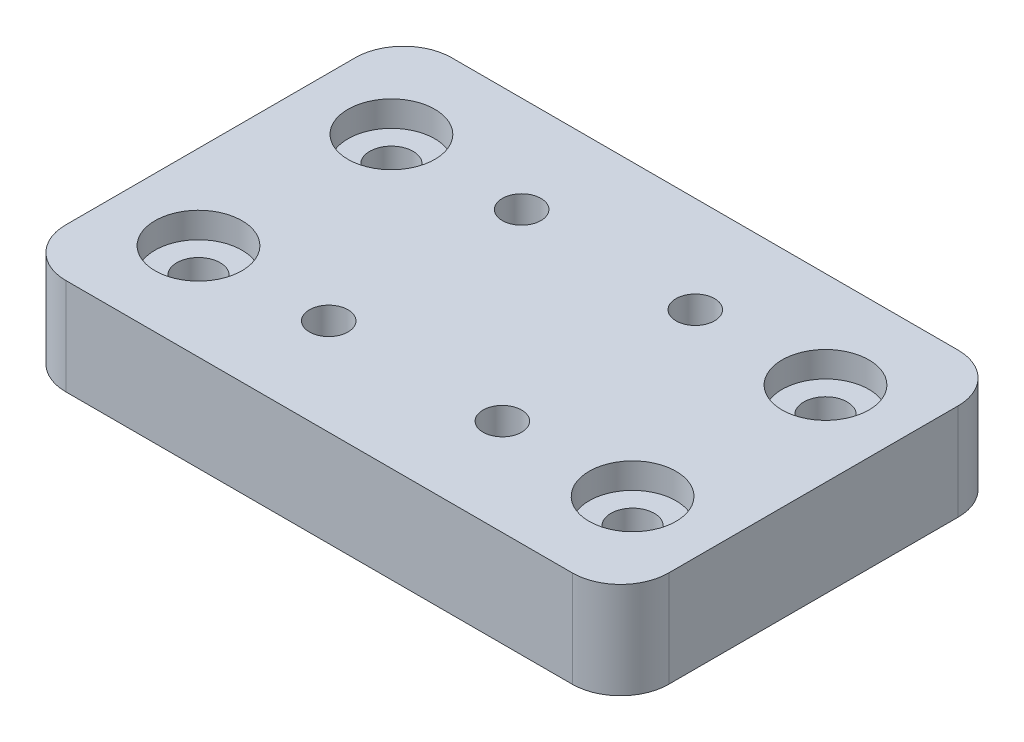
from build123d import *

# Parameters (mm, degrees)
DODANIE_WYCI_GNI_CIE1_DEPTH                       = 20
OTWORY_USTALAJ_CE_8_0MM1_D                        = 8
OTWORY_USTALAJ_CE_8_0MM1_DEPTH                    = 15
OTWORY_USTALAJ_CE_8_0MM1_TIP                      = 2.403442476
POG_BIENIE_WALCOWE_POD_M8_RUB_Z_BEM_S_D           = 9
POG_BIENIE_WALCOWE_POD_M8_RUB_Z_BEM_S_CBORE_D     = 18.011
POG_BIENIE_WALCOWE_POD_M8_RUB_Z_BEM_S_CBORE_DEPTH = 5.3


with BuildPart() as part:
    # Szkic1 → Dodanie-wyciągnięcie1 (new body)
    with BuildSketch(Plane(origin=(0, 0, 0), x_dir=(1, 0, 0), z_dir=(0, 1, 0))):
        with BuildLine():
            Line((-52.5, -40), (52.5, -40))
            ThreePointArc((52.5, -40), (59.571067812, -37.071067812), (62.5, -30))
            Line((62.5, -30), (62.5, 30))
            ThreePointArc((62.5, 30), (59.571067812, 37.071067812), (52.5, 40))
            Line((52.5, 40), (-52.5, 40))
            ThreePointArc((-52.5, 40), (-59.571067812, 37.071067812), (-62.5, 30))
            Line((-62.5, 30), (-62.5, -30))
            ThreePointArc((-62.5, -30), (-59.571067812, -37.071067812), (-52.5, -40))
        make_face()
    extrude(amount=DODANIE_WYCI_GNI_CIE1_DEPTH)

    # Otwory ustalające Ø8.0mm1
    with Locations(Plane(origin=(0, 20, 0), x_dir=(1, 0, 0), z_dir=(0, 1, 0))):
        with Locations((-18, -20), (18, -20), (18, 20), (-18, 20)):
            Hole(OTWORY_USTALAJ_CE_8_0MM1_D / 2, depth=OTWORY_USTALAJ_CE_8_0MM1_DEPTH)
            with Locations((0, 0, -(OTWORY_USTALAJ_CE_8_0MM1_DEPTH + OTWORY_USTALAJ_CE_8_0MM1_TIP / 2))):  # 118° drill point
                Cone(0, OTWORY_USTALAJ_CE_8_0MM1_D / 2, OTWORY_USTALAJ_CE_8_0MM1_TIP, mode=Mode.SUBTRACT)

    # Pogłębienie walcowe pod M8 śrubę z łbem szeciokątnym1 (through all)
    with Locations(Plane(origin=(0, 20, 0), x_dir=(1, 0, 0), z_dir=(0, 1, 0))):
        with Locations((-45, 20), (-45, -20), (45, -20), (45, 20)):
            CounterBoreHole(POG_BIENIE_WALCOWE_POD_M8_RUB_Z_BEM_S_D / 2, POG_BIENIE_WALCOWE_POD_M8_RUB_Z_BEM_S_CBORE_D / 2, POG_BIENIE_WALCOWE_POD_M8_RUB_Z_BEM_S_CBORE_DEPTH)


solid = part.part
